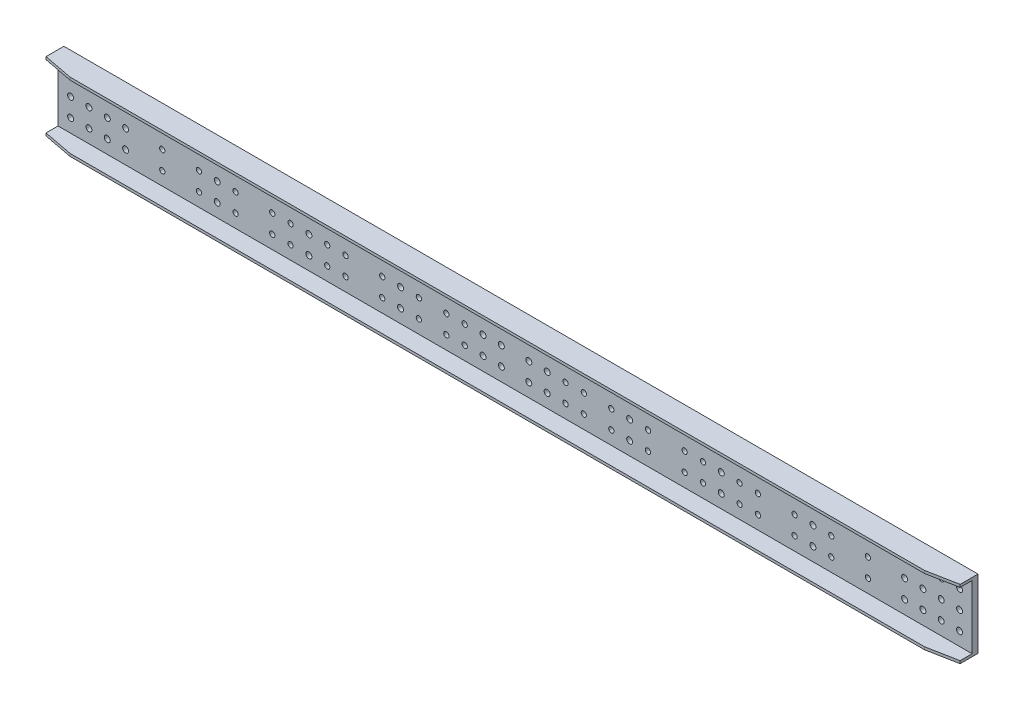
from build123d import *

# Parameters (mm, degrees)
SKETCH_1_W          = 3990
SKETCH_1_H          = 300
SKETCH_1_R          = 13
SKETCH_1_R_2        = 11.5
EXTRUDE_1534_DEPTH  = 25.5
SKETCH_2_W          = 3990
SKETCH_2_H          = 11.5
EXTRUDE_1_DEPTH     = 77.5
SKETCH_3_W          = 70
SKETCH_3_H          = 230
EXTRUDE_2_DEPTH     = 16
SKETCH_4_R          = 13
CUT_EXTRUDE_1_DEPTH = 2003.131676489
CUT_EXTRUDE_2_DEPTH = 2021.057919962


with BuildPart() as part:
    # 草图1 → Extrude 1534 (new body)
    with BuildSketch(Plane.XY):
        Rectangle(SKETCH_1_W, SKETCH_1_H)
        with Locations((1940, 80)):
            Circle(SKETCH_1_R, mode=Mode.SUBTRACT)
        with Locations((1860, 80)):
            Circle(SKETCH_1_R, mode=Mode.SUBTRACT)
        with Locations((1780, 80)):
            Circle(SKETCH_1_R, mode=Mode.SUBTRACT)
        with Locations((1700, 80)):
            Circle(SKETCH_1_R, mode=Mode.SUBTRACT)
        with Locations((1540, 80)):
            Circle(SKETCH_1_R_2, mode=Mode.SUBTRACT)
        with Locations((1380, 80)):
            Circle(SKETCH_1_R_2, mode=Mode.SUBTRACT)
        with Locations((1220, 80)):
            Circle(SKETCH_1_R_2, mode=Mode.SUBTRACT)
        with Locations((1060, 80)):
            Circle(SKETCH_1_R_2, mode=Mode.SUBTRACT)
        with Locations((980, 80)):
            Circle(SKETCH_1_R_2, mode=Mode.SUBTRACT)
        with Locations((820, 80)):
            Circle(SKETCH_1_R_2, mode=Mode.SUBTRACT)
        with Locations((740, 80)):
            Circle(SKETCH_1_R_2, mode=Mode.SUBTRACT)
        with Locations((580, 80)):
            Circle(SKETCH_1_R_2, mode=Mode.SUBTRACT)
        with Locations((980, 0)):
            Circle(SKETCH_1_R_2, mode=Mode.SUBTRACT)
        with Locations((1060, 0)):
            Circle(SKETCH_1_R_2, mode=Mode.SUBTRACT)
        with Locations((820, 0)):
            Circle(SKETCH_1_R_2, mode=Mode.SUBTRACT)
        with Locations((740, 0)):
            Circle(SKETCH_1_R_2, mode=Mode.SUBTRACT)
        with Locations((580, 0)):
            Circle(SKETCH_1_R_2, mode=Mode.SUBTRACT)
        with Locations((1220, 0)):
            Circle(SKETCH_1_R_2, mode=Mode.SUBTRACT)
        with Locations((1380, 0)):
            Circle(SKETCH_1_R_2, mode=Mode.SUBTRACT)
        with Locations((1540, 0)):
            Circle(SKETCH_1_R_2, mode=Mode.SUBTRACT)
        with Locations((1700, 0)):
            Circle(SKETCH_1_R, mode=Mode.SUBTRACT)
        with Locations((1780, 0)):
            Circle(SKETCH_1_R, mode=Mode.SUBTRACT)
        with Locations((1860, 0)):
            Circle(SKETCH_1_R, mode=Mode.SUBTRACT)
        with Locations((1940, 0)):
            Circle(SKETCH_1_R, mode=Mode.SUBTRACT)
        with Locations((420, 80)):
            Circle(SKETCH_1_R_2, mode=Mode.SUBTRACT)
        with Locations((420, 0)):
            Circle(SKETCH_1_R_2, mode=Mode.SUBTRACT)
        with Locations((300, 0)):
            Circle(SKETCH_1_R_2, mode=Mode.SUBTRACT)
        with Locations((300, 80)):
            Circle(SKETCH_1_R_2, mode=Mode.SUBTRACT)
        with Locations((220, 80)):
            Circle(SKETCH_1_R_2, mode=Mode.SUBTRACT)
        with Locations((220, 0)):
            Circle(SKETCH_1_R_2, mode=Mode.SUBTRACT)
        with Locations((140, 0)):
            Circle(SKETCH_1_R, mode=Mode.SUBTRACT)
        with Locations((140, 80)):
            Circle(SKETCH_1_R, mode=Mode.SUBTRACT)
        with Locations((60, 80)):
            Circle(SKETCH_1_R, mode=Mode.SUBTRACT)
        with Locations((60, 0)):
            Circle(SKETCH_1_R, mode=Mode.SUBTRACT)
        with Locations(Location((1700, -80, 0), (0, 0, 180))):
            Circle(SKETCH_1_R, mode=Mode.SUBTRACT)
        with Locations(Location((1780, -80, 0), (0, 0, 180))):
            Circle(SKETCH_1_R, mode=Mode.SUBTRACT)
        with Locations(Location((1860, -80, 0), (0, 0, 180))):
            Circle(SKETCH_1_R, mode=Mode.SUBTRACT)
        with Locations(Location((1940, -80, 0), (0, 0, 180))):
            Circle(SKETCH_1_R, mode=Mode.SUBTRACT)
        with Locations(Location((580, -80, 0), (0, 0, 180))):
            Circle(SKETCH_1_R_2, mode=Mode.SUBTRACT)
        with Locations(Location((740, -80, 0), (0, 0, 180))):
            Circle(SKETCH_1_R_2, mode=Mode.SUBTRACT)
        with Locations(Location((820, -80, 0), (0, 0, 180))):
            Circle(SKETCH_1_R_2, mode=Mode.SUBTRACT)
        with Locations(Location((980, -80, 0), (0, 0, 180))):
            Circle(SKETCH_1_R_2, mode=Mode.SUBTRACT)
        with Locations(Location((1060, -80, 0), (0, 0, 180))):
            Circle(SKETCH_1_R_2, mode=Mode.SUBTRACT)
        with Locations(Location((1220, -80, 0), (0, 0, 180))):
            Circle(SKETCH_1_R_2, mode=Mode.SUBTRACT)
        with Locations(Location((1380, -80, 0), (0, 0, 180))):
            Circle(SKETCH_1_R_2, mode=Mode.SUBTRACT)
        with Locations(Location((1540, -80, 0), (0, 0, 180))):
            Circle(SKETCH_1_R_2, mode=Mode.SUBTRACT)
        with Locations(Location((220, -80, 0), (0, 0, 180))):
            Circle(SKETCH_1_R_2, mode=Mode.SUBTRACT)
        with Locations(Location((300, -80, 0), (0, 0, 180))):
            Circle(SKETCH_1_R_2, mode=Mode.SUBTRACT)
        with Locations(Location((420, -80, 0), (0, 0, 180))):
            Circle(SKETCH_1_R_2, mode=Mode.SUBTRACT)
        with Locations(Location((60, -80, 0), (0, 0, 180))):
            Circle(SKETCH_1_R, mode=Mode.SUBTRACT)
        with Locations(Location((140, -80, 0), (0, 0, 180))):
            Circle(SKETCH_1_R, mode=Mode.SUBTRACT)
        with Locations((-140, -80)):
            Circle(SKETCH_1_R, mode=Mode.SUBTRACT)
        with Locations((-60, -80)):
            Circle(SKETCH_1_R, mode=Mode.SUBTRACT)
        with Locations((-580, -80)):
            Circle(SKETCH_1_R_2, mode=Mode.SUBTRACT)
        with Locations((-420, -80)):
            Circle(SKETCH_1_R_2, mode=Mode.SUBTRACT)
        with Locations((-300, -80)):
            Circle(SKETCH_1_R_2, mode=Mode.SUBTRACT)
        with Locations((-220, -80)):
            Circle(SKETCH_1_R_2, mode=Mode.SUBTRACT)
        with Locations((-1540, -80)):
            Circle(SKETCH_1_R_2, mode=Mode.SUBTRACT)
        with Locations((-1380, -80)):
            Circle(SKETCH_1_R_2, mode=Mode.SUBTRACT)
        with Locations((-1220, -80)):
            Circle(SKETCH_1_R_2, mode=Mode.SUBTRACT)
        with Locations((-1060, -80)):
            Circle(SKETCH_1_R_2, mode=Mode.SUBTRACT)
        with Locations((-980, -80)):
            Circle(SKETCH_1_R_2, mode=Mode.SUBTRACT)
        with Locations((-820, -80)):
            Circle(SKETCH_1_R_2, mode=Mode.SUBTRACT)
        with Locations((-740, -80)):
            Circle(SKETCH_1_R_2, mode=Mode.SUBTRACT)
        with Locations((-1940, -80)):
            Circle(SKETCH_1_R, mode=Mode.SUBTRACT)
        with Locations((-1860, -80)):
            Circle(SKETCH_1_R, mode=Mode.SUBTRACT)
        with Locations((-1780, -80)):
            Circle(SKETCH_1_R, mode=Mode.SUBTRACT)
        with Locations((-1700, -80)):
            Circle(SKETCH_1_R, mode=Mode.SUBTRACT)
        with Locations(Location((-60, 0, 0), (0, 0, 180))):
            Circle(SKETCH_1_R, mode=Mode.SUBTRACT)
        with Locations(Location((-60, 80, 0), (0, 0, 180))):
            Circle(SKETCH_1_R, mode=Mode.SUBTRACT)
        with Locations(Location((-140, 80, 0), (0, 0, 180))):
            Circle(SKETCH_1_R, mode=Mode.SUBTRACT)
        with Locations(Location((-140, 0, 0), (0, 0, 180))):
            Circle(SKETCH_1_R, mode=Mode.SUBTRACT)
        with Locations(Location((-220, 0, 0), (0, 0, 180))):
            Circle(SKETCH_1_R_2, mode=Mode.SUBTRACT)
        with Locations(Location((-220, 80, 0), (0, 0, 180))):
            Circle(SKETCH_1_R_2, mode=Mode.SUBTRACT)
        with Locations(Location((-300, 80, 0), (0, 0, 180))):
            Circle(SKETCH_1_R_2, mode=Mode.SUBTRACT)
        with Locations(Location((-300, 0, 0), (0, 0, 180))):
            Circle(SKETCH_1_R_2, mode=Mode.SUBTRACT)
        with Locations(Location((-420, 0, 0), (0, 0, 180))):
            Circle(SKETCH_1_R_2, mode=Mode.SUBTRACT)
        with Locations(Location((-420, 80, 0), (0, 0, 180))):
            Circle(SKETCH_1_R_2, mode=Mode.SUBTRACT)
        with Locations(Location((-1940, 0, 0), (0, 0, 180))):
            Circle(SKETCH_1_R, mode=Mode.SUBTRACT)
        with Locations(Location((-1860, 0, 0), (0, 0, 180))):
            Circle(SKETCH_1_R, mode=Mode.SUBTRACT)
        with Locations(Location((-1780, 0, 0), (0, 0, 180))):
            Circle(SKETCH_1_R, mode=Mode.SUBTRACT)
        with Locations(Location((-1700, 0, 0), (0, 0, 180))):
            Circle(SKETCH_1_R, mode=Mode.SUBTRACT)
        with Locations(Location((-1540, 0, 0), (0, 0, 180))):
            Circle(SKETCH_1_R_2, mode=Mode.SUBTRACT)
        with Locations(Location((-1380, 0, 0), (0, 0, 180))):
            Circle(SKETCH_1_R_2, mode=Mode.SUBTRACT)
        with Locations(Location((-1220, 0, 0), (0, 0, 180))):
            Circle(SKETCH_1_R_2, mode=Mode.SUBTRACT)
        with Locations(Location((-580, 0, 0), (0, 0, 180))):
            Circle(SKETCH_1_R_2, mode=Mode.SUBTRACT)
        with Locations(Location((-740, 0, 0), (0, 0, 180))):
            Circle(SKETCH_1_R_2, mode=Mode.SUBTRACT)
        with Locations(Location((-820, 0, 0), (0, 0, 180))):
            Circle(SKETCH_1_R_2, mode=Mode.SUBTRACT)
        with Locations(Location((-1060, 0, 0), (0, 0, 180))):
            Circle(SKETCH_1_R_2, mode=Mode.SUBTRACT)
        with Locations(Location((-980, 0, 0), (0, 0, 180))):
            Circle(SKETCH_1_R_2, mode=Mode.SUBTRACT)
        with Locations(Location((-580, 80, 0), (0, 0, 180))):
            Circle(SKETCH_1_R_2, mode=Mode.SUBTRACT)
        with Locations(Location((-740, 80, 0), (0, 0, 180))):
            Circle(SKETCH_1_R_2, mode=Mode.SUBTRACT)
        with Locations(Location((-820, 80, 0), (0, 0, 180))):
            Circle(SKETCH_1_R_2, mode=Mode.SUBTRACT)
        with Locations(Location((-980, 80, 0), (0, 0, 180))):
            Circle(SKETCH_1_R_2, mode=Mode.SUBTRACT)
        with Locations(Location((-1060, 80, 0), (0, 0, 180))):
            Circle(SKETCH_1_R_2, mode=Mode.SUBTRACT)
        with Locations(Location((-1220, 80, 0), (0, 0, 180))):
            Circle(SKETCH_1_R_2, mode=Mode.SUBTRACT)
        with Locations(Location((-1380, 80, 0), (0, 0, 180))):
            Circle(SKETCH_1_R_2, mode=Mode.SUBTRACT)
        with Locations(Location((-1540, 80, 0), (0, 0, 180))):
            Circle(SKETCH_1_R_2, mode=Mode.SUBTRACT)
        with Locations(Location((-1700, 80, 0), (0, 0, 180))):
            Circle(SKETCH_1_R, mode=Mode.SUBTRACT)
        with Locations(Location((-1780, 80, 0), (0, 0, 180))):
            Circle(SKETCH_1_R, mode=Mode.SUBTRACT)
        with Locations(Location((-1860, 80, 0), (0, 0, 180))):
            Circle(SKETCH_1_R, mode=Mode.SUBTRACT)
        with Locations(Location((-1940, 80, 0), (0, 0, 180))):
            Circle(SKETCH_1_R, mode=Mode.SUBTRACT)
    extrude(amount=EXTRUDE_1534_DEPTH)

    # 草图2 → 凸台-拉伸1 (add)
    with BuildSketch(Plane.XY.offset(25.5)):
        with Locations((0, 144.25)):
            Rectangle(SKETCH_2_W, SKETCH_2_H)
        with Locations((0, -144.25)):
            Rectangle(SKETCH_2_W, SKETCH_2_H)
    extrude(amount=EXTRUDE_1_DEPTH)

    # 草图3 → 凸台-拉伸2 (add)
    with BuildSketch(Plane(origin=(0, 0, 0), x_dir=(-1, 0, 0), z_dir=(0, 0, -1))):
        with Locations((1300, 0)):
            Rectangle(SKETCH_3_W, SKETCH_3_H)
        with Locations((900, 0)):
            Rectangle(SKETCH_3_W, SKETCH_3_H)
        with Locations((-1300, 0)):
            Rectangle(SKETCH_3_W, SKETCH_3_H)
        with Locations((500, 0)):
            Rectangle(SKETCH_3_W, SKETCH_3_H)
        with Locations((-900, 0)):
            Rectangle(SKETCH_3_W, SKETCH_3_H)
        with Locations((-500, 0)):
            Rectangle(SKETCH_3_W, SKETCH_3_H)
    extrude(amount=EXTRUDE_2_DEPTH)

    # 草图4 → 切除-拉伸1 (cut, through all)
    with BuildSketch(Plane.XY.offset(25.5)):
        with Locations((1300, 80)):
            Circle(SKETCH_4_R)
        with Locations((900, 80)):
            Circle(SKETCH_4_R)
        with Locations((900, 0)):
            Circle(SKETCH_4_R)
        with Locations((1300, 0)):
            Circle(SKETCH_4_R)
        with Locations((900, -80)):
            Circle(SKETCH_4_R)
        with Locations((1300, -80)):
            Circle(SKETCH_4_R)
        with Locations((500, 80)):
            Circle(SKETCH_4_R)
        with Locations((500, 0)):
            Circle(SKETCH_4_R)
        with Locations((500, -80)):
            Circle(SKETCH_4_R)
        with Locations((-500, -80)):
            Circle(SKETCH_4_R)
        with Locations((-500, 0)):
            Circle(SKETCH_4_R)
        with Locations((-500, 80)):
            Circle(SKETCH_4_R)
        with Locations((-1300, -80)):
            Circle(SKETCH_4_R)
        with Locations((-900, -80)):
            Circle(SKETCH_4_R)
        with Locations((-1300, 0)):
            Circle(SKETCH_4_R)
        with Locations((-900, 0)):
            Circle(SKETCH_4_R)
        with Locations((-900, 80)):
            Circle(SKETCH_4_R)
        with Locations((-1300, 80)):
            Circle(SKETCH_4_R)
    extrude(amount=-CUT_EXTRUDE_1_DEPTH, mode=Mode.SUBTRACT)

    # 草图5 → 切除-拉伸2 (cut, through all)
    with BuildSketch(Plane(origin=(0, 150, 0), x_dir=(-1, 0, 0), z_dir=(0, 1, 0))):
        Polygon((-1995, 78), (-1995, 103), (-1865, 103), align=None)
        Polygon((1865, 103), (1995, 78), (1995, 103), align=None)
    extrude(amount=-CUT_EXTRUDE_2_DEPTH, mode=Mode.SUBTRACT)


solid = part.part
